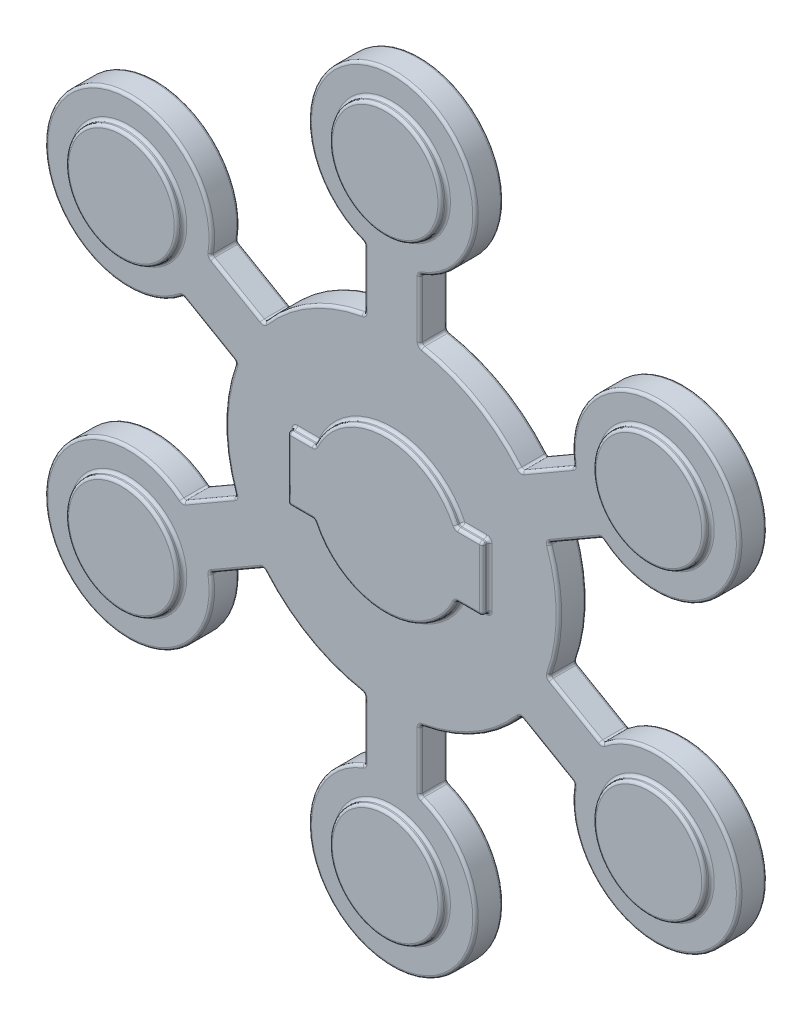
from build123d import *

# Parameters (mm, degrees)
BOSS_EXTRUDE1_DEPTH   = 7.5
SKETCH1_R             = 20
BOSS_EXTRUDE1_2_DEPTH = 7.5
BOSS_EXTRUDE1_3_DEPTH = 7.5
BOSS_EXTRUDE1_4_DEPTH = 7.5
BOSS_EXTRUDE1_5_DEPTH = 7.5
BOSS_EXTRUDE1_6_DEPTH = 7.5
BOSS_EXTRUDE1_7_DEPTH = 7.5
SKETCH1_4_R           = 20
BOSS_EXTRUDE2_DEPTH   = 5
FILLET1_R             = 1


with BuildPart() as part:
    # Sketch1 → Boss-Extrude1 (new, symmetric)
    with BuildSketch(Plane.XY):
        with BuildLine():
            Line((35, 11.5), (25.529394822, 11.5))
            ThreePointArc((25.529394822, 11.5), (0, 28), (-25.529394822, 11.5))
            Line((-25.529394822, 11.5), (-35, 11.5))
            Line((-35, 11.5), (-35, -11.5))
            Line((-35, -11.5), (-25.529394822, -11.5))
            ThreePointArc((-25.529394822, -11.5), (0, -28), (25.529394822, -11.5))
            Line((25.529394822, -11.5), (35, -11.5))
            Line((35, -11.5), (35, 11.5))
        make_face()
    extrude(amount=BOSS_EXTRUDE1_DEPTH, both=True)



with BuildPart() as body_2:
    # Sketch1 → Boss-Extrude1 2 (new, symmetric)
    with BuildSketch(Plane.XY):
        with Locations((0, 109.5)):
            Circle(SKETCH1_R)
    extrude(amount=BOSS_EXTRUDE1_2_DEPTH, both=True)


with BuildPart() as body_3:
    # Sketch1 → Boss-Extrude1 3 (new, symmetric)
    with BuildSketch(Plane.XY):
        with Locations((94.829781714, 54.75)):
            Circle(SKETCH1_R)
    extrude(amount=BOSS_EXTRUDE1_3_DEPTH, both=True)


with BuildPart() as body_4:
    # Sketch1 → Boss-Extrude1 4 (new, symmetric)
    with BuildSketch(Plane.XY):
        with Locations((94.829781714, -54.75)):
            Circle(SKETCH1_R)
    extrude(amount=BOSS_EXTRUDE1_4_DEPTH, both=True)


with BuildPart() as body_5:
    # Sketch1 → Boss-Extrude1 5 (new, symmetric)
    with BuildSketch(Plane.XY):
        with Locations((0, -109.5)):
            Circle(SKETCH1_R)
    extrude(amount=BOSS_EXTRUDE1_5_DEPTH, both=True)


with BuildPart() as body_6:
    # Sketch1 → Boss-Extrude1 6 (new, symmetric)
    with BuildSketch(Plane.XY):
        with Locations((-94.829781714, -54.75)):
            Circle(SKETCH1_R)
    extrude(amount=BOSS_EXTRUDE1_6_DEPTH, both=True)


with BuildPart() as body_7:
    # Sketch1 → Boss-Extrude1 7 (new, symmetric)
    with BuildSketch(Plane.XY):
        with Locations((-94.829781714, 54.75)):
            Circle(SKETCH1_R)
    extrude(amount=BOSS_EXTRUDE1_7_DEPTH, both=True)


with BuildPart() as part_1:
    add(part.part)

    add(body_2.part)  # Boss-Extrude2 merges body 2

    add(body_3.part)  # Boss-Extrude2 merges body 3

    add(body_4.part)  # Boss-Extrude2 merges body 4

    add(body_5.part)  # Boss-Extrude2 merges body 5

    add(body_6.part)  # Boss-Extrude2 merges body 6

    add(body_7.part)  # Boss-Extrude2 merges body 7
    # Sketch1<4> → Boss-Extrude2 (add, symmetric)
    with BuildSketch(Plane.XY):
        with BuildLine():
            Line((-10, 81.215728753), (-10, 59.160797831))
            ThreePointArc((-10, 59.160797831), (-30, 51.961524227), (-46.23475383, 38.240652953))
            Line((-46.23475383, 38.240652953), (-65.334884287, 49.268118414))
            ThreePointArc((-65.334884287, 49.268118414), (-120.810543828, 69.75), (-75.334884287, 31.947610338))
            Line((-75.334884287, 31.947610338), (-56.23475383, 20.920144878))
            ThreePointArc((-56.23475383, 20.920144878), (-60, 0), (-56.23475383, -20.920144878))
            Line((-56.23475383, -20.920144878), (-75.334884287, -31.947610338))
            ThreePointArc((-75.334884287, -31.947610338), (-120.810543828, -69.75), (-65.334884287, -49.268118414))
            Line((-65.334884287, -49.268118414), (-46.23475383, -38.240652953))
            ThreePointArc((-46.23475383, -38.240652953), (-30, -51.961524227), (-10, -59.160797831))
            Line((-10, -59.160797831), (-10, -81.215728753))
            ThreePointArc((-10, -81.215728753), (0, -139.5), (10, -81.215728753))
            Line((10, -81.215728753), (10, -59.160797831))
            ThreePointArc((10, -59.160797831), (30, -51.961524227), (46.23475383, -38.240652953))
            Line((46.23475383, -38.240652953), (65.334884287, -49.268118414))
            ThreePointArc((65.334884287, -49.268118414), (120.810543828, -69.75), (75.334884287, -31.947610338))
            Line((75.334884287, -31.947610338), (56.23475383, -20.920144878))
            ThreePointArc((56.23475383, -20.920144878), (60, 0), (56.23475383, 20.920144878))
            Line((56.23475383, 20.920144878), (75.334884287, 31.947610338))
            ThreePointArc((75.334884287, 31.947610338), (120.810543828, 69.75), (65.334884287, 49.268118414))
            Line((65.334884287, 49.268118414), (46.23475383, 38.240652953))
            ThreePointArc((46.23475383, 38.240652953), (30, 51.961524227), (10, 59.160797831))
            Line((10, 59.160797831), (10, 81.215728753))
            ThreePointArc((10, 81.215728753), (0, 139.5), (-10, 81.215728753))
        make_face()
        with Locations((0, 109.5)):
            Circle(SKETCH1_4_R, mode=Mode.SUBTRACT)
        with BuildLine():
            Line((25.529394822, 11.5), (35, 11.5))
            Line((35, 11.5), (35, -11.5))
            Line((35, -11.5), (25.529394822, -11.5))
            ThreePointArc((25.529394822, -11.5), (0, -28), (-25.529394822, -11.5))
            Line((-25.529394822, -11.5), (-35, -11.5))
            Line((-35, -11.5), (-35, 11.5))
            Line((-35, 11.5), (-25.529394822, 11.5))
            ThreePointArc((-25.529394822, 11.5), (0, 28), (25.529394822, 11.5))
        make_face(mode=Mode.SUBTRACT)
        with Locations((94.829781714, 54.75)):
            Circle(SKETCH1_4_R, mode=Mode.SUBTRACT)
        with Locations((94.829781714, -54.75)):
            Circle(SKETCH1_4_R, mode=Mode.SUBTRACT)
        with Locations((0, -109.5)):
            Circle(SKETCH1_4_R, mode=Mode.SUBTRACT)
        with Locations((-94.829781714, -54.75)):
            Circle(SKETCH1_4_R, mode=Mode.SUBTRACT)
        with Locations((-94.829781714, 54.75)):
            Circle(SKETCH1_4_R, mode=Mode.SUBTRACT)
    extrude(amount=BOSS_EXTRUDE2_DEPTH, both=True)

    # Fillet1
    fillet1_edges = [part_1.edges().sort_by_distance(p)[0] for p in [
        (0, 139.5, 5),
        (0, 139.5, -5),
        (-114.829781714, 54.75, -5),
        (-114.829781714, 54.75, 7.5),
        (-114.829781714, 54.75, -7.5),
        (56.23475383, 20.920144878, 0),
        (75.334884287, 31.947610338, 0),
        (65.334884287, 49.268118414, 0),
        (46.23475383, 38.240652953, 0),
        (10, 59.160797831, 0),
        (10, 81.215728753, 0),
        (-10, 81.215728753, 0),
        (-10, 59.160797831, 0),
        (-46.23475383, 38.240652953, 0),
        (-65.334884287, 49.268118414, 0),
        (-75.334884287, 31.947610338, 0),
        (-56.23475383, 20.920144878, 0),
        (-56.23475383, -20.920144878, 0),
        (-75.334884287, -31.947610338, 0),
        (-65.334884287, -49.268118414, 0),
        (-46.23475383, -38.240652953, 0),
        (-10, -59.160797831, 0),
        (-10, -81.215728753, 0),
        (10, -81.215728753, 0),
        (10, -59.160797831, 0),
        (46.23475383, -38.240652953, 0),
        (65.334884287, -49.268118414, 0),
        (75.334884287, -31.947610338, 0),
        (56.23475383, -20.920144878, 0),
        (74.829781714, 54.75, 5),
        (-20, 109.5, 5),
        (-114.829781714, 54.75, 5),
        (-114.829781714, -54.75, 5),
        (-20, -109.5, 5),
        (74.829781714, -54.75, 5),
        (65.784819058, -26.433877608, 5),
        (120.810543828, -69.75, 5),
        (55.784819058, -43.754385684, 5),
        (30, -51.961524227, 5),
        (10, -70.188263292, 5),
        (0, -139.5, 5),
        (-10, -70.188263292, 5),
        (-30, -51.961524227, 5),
        (-55.784819058, -43.754385684, 5),
        (-120.810543828, -69.75, 5),
        (-65.784819058, -26.433877608, 5),
        (-60, 0, 5),
        (-65.784819058, 26.433877608, 5),
        (-120.810543828, 69.75, 5),
        (-55.784819058, 43.754385684, 5),
        (-30, 51.961524227, 5),
        (-10, 70.188263292, 5),
        (10, 70.188263292, 5),
        (30, 51.961524227, 5),
        (55.784819058, 43.754385684, 5),
        (120.810543828, 69.75, 5),
        (65.784819058, 26.433877608, 5),
        (60, 0, 5),
        (-30.264697411, 11.5, 5),
        (-35, 0, 5),
        (-30.264697411, -11.5, 5),
        (0, -28, 5),
        (30.264697411, -11.5, 5),
        (35, 0, 5),
        (30.264697411, 11.5, 5),
        (0, 28, 5),
        (65.784819058, -26.433877608, -5),
        (120.810543828, -69.75, -5),
        (55.784819058, -43.754385684, -5),
        (30, -51.961524227, -5),
        (10, -70.188263292, -5),
        (0, -139.5, -5),
        (-10, -70.188263292, -5),
        (-30, -51.961524227, -5),
        (-55.784819058, -43.754385684, -5),
        (-120.810543828, -69.75, -5),
        (-65.784819058, -26.433877608, -5),
        (-60, 0, -5),
        (-65.784819058, 26.433877608, -5),
        (-120.810543828, 69.75, -5),
        (-55.784819058, 43.754385684, -5),
        (-30, 51.961524227, -5),
        (-10, 70.188263292, -5),
        (10, 70.188263292, -5),
        (30, 51.961524227, -5),
        (55.784819058, 43.754385684, -5),
        (120.810543828, 69.75, -5),
        (65.784819058, 26.433877608, -5),
        (60, 0, -5),
        (-30.264697411, 11.5, -5),
        (-35, 0, -5),
        (-30.264697411, -11.5, -5),
        (0, -28, -5),
        (30.264697411, -11.5, -5),
        (35, 0, -5),
        (30.264697411, 11.5, -5),
        (0, 28, -5),
        (-20, 109.5, -5),
        (-20, 109.5, 7.5),
        (-20, 109.5, -7.5),
        (74.829781714, 54.75, -5),
        (74.829781714, 54.75, 7.5),
        (74.829781714, 54.75, -7.5),
        (74.829781714, -54.75, -5),
        (74.829781714, -54.75, 7.5),
        (74.829781714, -54.75, -7.5),
        (-20, -109.5, -5),
        (-20, -109.5, 7.5),
        (-20, -109.5, -7.5),
        (-114.829781714, -54.75, -5),
        (-114.829781714, -54.75, 7.5),
        (-114.829781714, -54.75, -7.5),
        (25.529394822, 11.5, 6.25),
        (25.529394822, 11.5, -6.25),
        (-25.529394822, 11.5, 6.25),
        (-25.529394822, 11.5, -6.25),
        (-35, 11.5, 6.25),
        (-35, 11.5, -6.25),
        (-35, -11.5, 6.25),
        (-35, -11.5, -6.25),
        (-25.529394822, -11.5, 6.25),
        (-25.529394822, -11.5, -6.25),
        (25.529394822, -11.5, 6.25),
        (25.529394822, -11.5, -6.25),
        (35, -11.5, 6.25),
        (35, -11.5, -6.25),
        (35, 11.5, 6.25),
        (35, 11.5, -6.25),
        (35, 0, 7.5),
        (30.264697411, -11.5, 7.5),
        (0, -28, 7.5),
        (-30.264697411, -11.5, 7.5),
        (-35, 0, 7.5),
        (-30.264697411, 11.5, 7.5),
        (0, 28, 7.5),
        (30.264697411, 11.5, 7.5),
        (35, 0, -7.5),
        (30.264697411, -11.5, -7.5),
        (0, -28, -7.5),
        (-30.264697411, -11.5, -7.5),
        (-35, 0, -7.5),
        (-30.264697411, 11.5, -7.5),
        (0, 28, -7.5),
        (30.264697411, 11.5, -7.5),
    ]]
    fillet(fillet1_edges, radius=FILLET1_R)


solid = part_1.part
